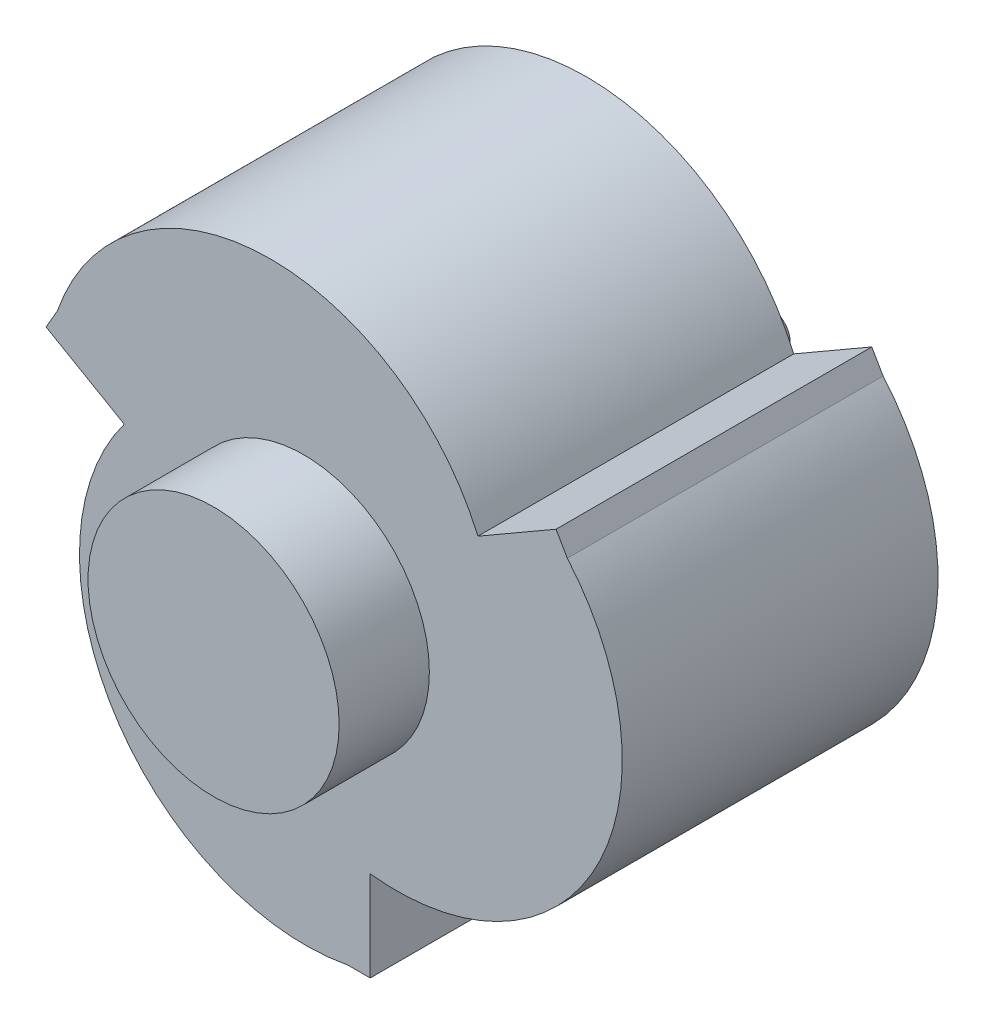
from build123d import *

# Parameters (mm, degrees)
SALIENTE_EXTRUIR1_DEPTH = 18
SALIENTE_EXTRUIR2_START = 1.5
CROQUIS2_R              = 2.7
SALIENTE_EXTRUIR2_DEPTH = 1.5
SALIENTE_EXTRUIR3_DEPTH = 1.5
CROQUIS6_W              = 5.4
CROQUIS6_H              = 1.803822617
SALIENTE_EXTRUIR7_DEPTH = 10
CROQUIS10_W             = 5.4
CROQUIS10_H             = 10
CORTAR_EXTRUIR3_DEPTH   = 10
CROQUIS11_W             = 8.35
CROQUIS11_H             = 6


with BuildPart() as part:
    # Croquis1 → Saliente-Extruir1 (new body)
    with BuildSketch(Plane.XY):
        with BuildLine():
            Line((-53.667784589, 33.4650382), (-54.417784589, 34.764076306))
            Line((-54.417784589, 34.764076306), (-59.613937012, 31.764076306))
            ThreePointArc((-59.613937012, 31.764076306), (-73.945502317, 40.827707086), (-87.584573208, 30.752047693))
            Line((-87.584573208, 30.752047693), (-88.334573208, 29.453009587))
            Line((-88.334573208, 29.453009587), (-83.138420786, 26.453009587))
            ThreePointArc((-83.138420786, 26.453009587), (-83.82197264, 9.509694567), (-68.276660199, 2.735742387))
            Line((-68.276660199, 2.735742387), (-66.776660199, 2.735742387))
            Line((-66.776660199, 2.735742387), (-66.776660199, 8.735742387))
            ThreePointArc((-66.776660199, 8.735742387), (-51.761543041, 16.615426627), (-53.667784589, 33.4650382))
        make_face()
        with BuildLine():
            Line((-54.507549641, 31.745180452), (-55.016343575, 32.626437397))
            Line((-55.016343575, 32.626437397), (-60.212495998, 29.626437397))
            ThreePointArc((-60.212495998, 29.626437397), (-72.508207296, 39.071771198), (-85.675250182, 30.884718699))
            Line((-85.675250182, 30.884718699), (-86.184044116, 30.003461754))
            Line((-86.184044116, 30.003461754), (-80.987891693, 27.003461754))
            ThreePointArc((-80.987891693, 27.003461754), (-83.019935064, 11.632396511), (-69.346218174, 4.322929129))
            Line((-69.346218174, 4.322929129), (-68.328630306, 4.322929129))
            Line((-68.328630306, 4.322929129), (-68.328630306, 10.322929129))
            ThreePointArc((-68.328630306, 10.322929129), (-54.000875637, 16.248660571), (-54.507549641, 31.745180452))
        make_face(mode=Mode.SUBTRACT)
    extrude(amount=SALIENTE_EXTRUIR1_DEPTH)

    # Croquis2 → Saliente-Extruir2 (add)
    with BuildSketch(Plane(origin=(0, 0, 0), x_dir=(-1, 0, 0), z_dir=(0, 0, -1)).offset(SALIENTE_EXTRUIR2_START)):
        with BuildLine():
            Line((87.584573208, 30.752047693), (88.334573208, 29.453009587))
            Line((88.334573208, 29.453009587), (83.138420786, 26.453009587))
            ThreePointArc((83.138420786, 26.453009587), (83.82197264, 9.509694567), (68.276660199, 2.735742387))
            Line((68.276660199, 2.735742387), (66.776660199, 2.735742387))
            Line((66.776660199, 2.735742387), (66.776660199, 8.735742387))
            ThreePointArc((66.776660199, 8.735742387), (51.761543041, 16.615426627), (53.667784589, 33.4650382))
            Line((53.667784589, 33.4650382), (54.417784589, 34.764076306))
            Line((54.417784589, 34.764076306), (59.613937012, 31.764076306))
            ThreePointArc((59.613937012, 31.764076306), (73.945502317, 40.827707086), (87.584573208, 30.752047693))
        make_face()
        with Locations((69.843005999, 22.317609427)):
            Circle(CROQUIS2_R, mode=Mode.SUBTRACT)
    extrude(amount=-SALIENTE_EXTRUIR2_DEPTH)

    # Croquis3 → Saliente-Extruir3 (add)
    with BuildSketch(Plane.XY.offset(18)):
        with BuildLine():
            Line((-66.776660199, 8.735742387), (-66.776660199, 2.735742387))
            Line((-66.776660199, 2.735742387), (-68.276660199, 2.735742387))
            ThreePointArc((-68.276660199, 2.735742387), (-83.82197264, 9.509694567), (-83.138420786, 26.453009587))
            Line((-83.138420786, 26.453009587), (-88.334573208, 29.453009587))
            Line((-88.334573208, 29.453009587), (-87.584573208, 30.752047693))
            ThreePointArc((-87.584573208, 30.752047693), (-73.945502317, 40.827707086), (-59.613937012, 31.764076306))
            Line((-59.613937012, 31.764076306), (-54.417784589, 34.764076306))
            Line((-54.417784589, 34.764076306), (-53.667784589, 33.4650382))
            ThreePointArc((-53.667784589, 33.4650382), (-51.761543041, 16.615426627), (-66.776660199, 8.735742387))
        make_face()
    extrude(amount=SALIENTE_EXTRUIR3_DEPTH)

    # Croquis6 → Saliente-Extruir7 (add)
    with BuildSketch(Plane(origin=(0, 0, -1.5), x_dir=(-1, 0, 0), z_dir=(0, 0, -1))):
        with Locations((69.843005999, 21.415698119)):
            Rectangle(CROQUIS6_W, CROQUIS6_H)
    extrude(amount=SALIENTE_EXTRUIR7_DEPTH)

    # Croquis10 → Cortar-Extruir3 (cut)
    with BuildSketch(Plane(origin=(0, 22.317609427, 0), x_dir=(1, 0, 0), z_dir=(0, 1, 0))):
        with Locations((-69.843005999, 6.5)):
            Rectangle(CROQUIS10_W, CROQUIS10_H)
    extrude(amount=-CORTAR_EXTRUIR3_DEPTH, mode=Mode.SUBTRACT)

    # Croquis11 → Revolución1 (revolve)
    with BuildSketch(Plane(origin=(0, 22.317609427, 0), x_dir=(1, 0, 0), z_dir=(0, 1, 0)), mode=Mode.PRIVATE) as revoluci_n1_sk:
        Polygon((-72.543005999, 1.5), (-79.543005999, 1.5), (-72.543005999, 11.5), align=None)
        with Locations((-75.368005999, -22.5)):
            Rectangle(CROQUIS11_W, CROQUIS11_H)
    revolve(revoluci_n1_sk.sketch.rotate(Axis((-71.193005999, 22.317609427, 25.5), (0, 0, -1)), 180), axis=Axis((-71.193005999, 22.317609427, 25.5), (0, 0, -1)))


solid = part.part
